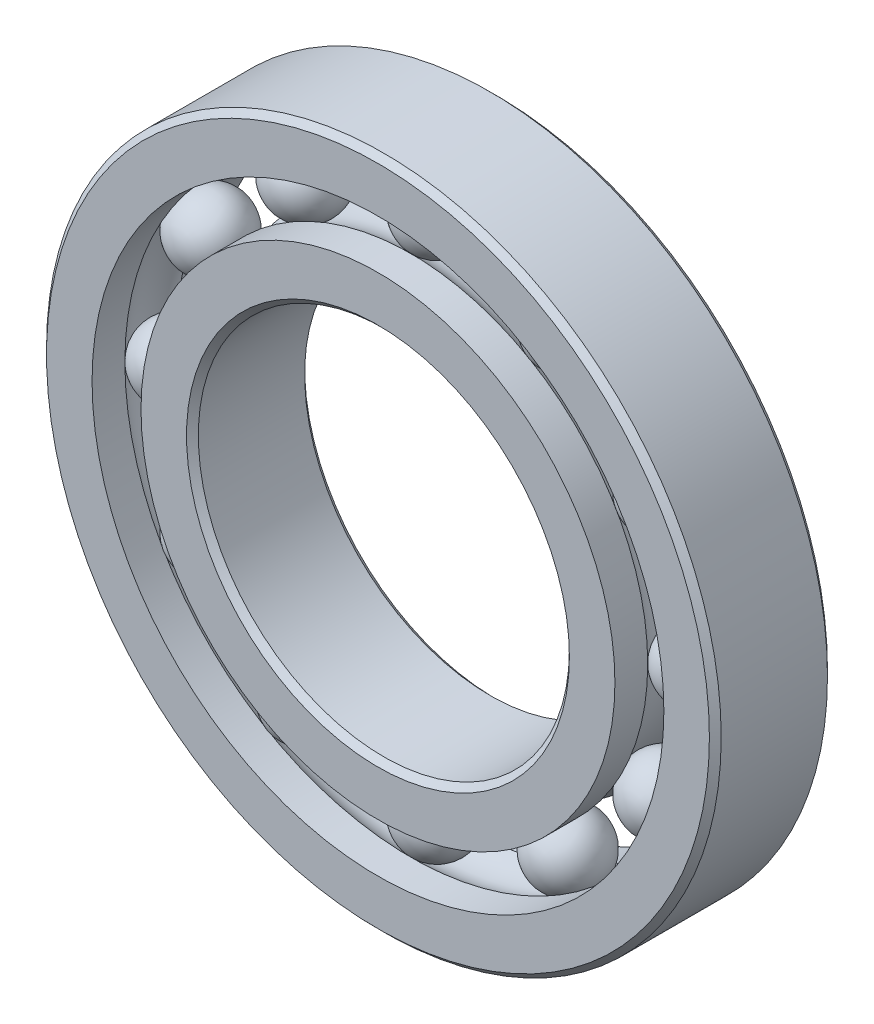
from build123d import *

# Parameters (mm, degrees)
CIRPATTERN1_COUNT = 12


with BuildPart() as part:
    # Sketch1 → Revolve1 (revolve)
    with BuildSketch(Plane(origin=(0, 0, 0), x_dir=(0, 0, -1), z_dir=(1, 0, 0))):
        with BuildLine():
            Line((5.000625, 31.75), (-5.000625, 31.75))
            Line((-5.000625, 31.75), (-5.55625, 31.194375))
            Line((-5.55625, 31.194375), (-5.55625, 26.908997253))
            Line((-5.55625, 26.908997253), (-2.469444444, 26.908997253))
            ThreePointArc((-2.469444444, 26.908997253), (0, 27.982757186), (2.469444444, 26.908997253))
            Line((2.469444444, 26.908997253), (5.55625, 26.908997253))
            Line((5.55625, 26.908997253), (5.55625, 31.194375))
            Line((5.55625, 31.194375), (5.000625, 31.75))
        make_face()
    revolve(axis=Axis((0, 0, 5.55625), (0, 0, -1)))


with BuildPart() as body_2:
    # Sketch3 → Revolve3 (revolve)
    with BuildSketch(Plane(origin=(0, 0, 0), x_dir=(0, 0, -1), z_dir=(1, 0, 0))):
        with BuildLine():
            Line((-5.55625, 22.303502747), (-2.469444444, 22.303502747))
            ThreePointArc((-2.469444444, 22.303502747), (0, 21.229742814), (2.469444444, 22.303502747))
            Line((2.469444444, 22.303502747), (5.55625, 22.303502747))
            Line((5.55625, 22.303502747), (5.55625, 18.018125))
            Line((5.55625, 18.018125), (5.000625, 17.4625))
            Line((5.000625, 17.4625), (-5.000625, 17.4625))
            Line((-5.000625, 17.4625), (-5.55625, 18.018125))
            Line((-5.55625, 18.018125), (-5.55625, 22.303502747))
        make_face()
    revolve(axis=Axis((0, 0, 5.55625), (0, 0, -1)))


with BuildPart() as body_3:
    # Sketch4 → Revolve4 (revolve)
    with BuildSketch(Plane(origin=(0, 0, 0), x_dir=(0, 0, -1), z_dir=(1, 0, 0))):
        with BuildLine():
            Line((-3.376507186, 24.60625), (3.376507186, 24.60625))
            ThreePointArc((3.376507186, 24.60625), (0, 27.982757186), (-3.376507186, 24.60625))
        make_face()
    revolve(axis=Axis((0, 24.60625, 3.376507186), (0, 0, -1)))


with BuildPart() as cirpattern1_1:
    # CirPattern1: pattern copy
    add(body_3.part.rotate(Axis((0, 0, -5.55625), (0, 0, 1)), 1 * 360 / CIRPATTERN1_COUNT))


with BuildPart() as cirpattern1_2:
    # CirPattern1: pattern copy
    add(body_3.part.rotate(Axis((0, 0, -5.55625), (0, 0, 1)), 2 * 360 / CIRPATTERN1_COUNT))


with BuildPart() as cirpattern1_3:
    # CirPattern1: pattern copy
    add(body_3.part.rotate(Axis((0, 0, -5.55625), (0, 0, 1)), 3 * 360 / CIRPATTERN1_COUNT))


with BuildPart() as cirpattern1_4:
    # CirPattern1: pattern copy
    add(body_3.part.rotate(Axis((0, 0, -5.55625), (0, 0, 1)), 4 * 360 / CIRPATTERN1_COUNT))


with BuildPart() as cirpattern1_5:
    # CirPattern1: pattern copy
    add(body_3.part.rotate(Axis((0, 0, -5.55625), (0, 0, 1)), 5 * 360 / CIRPATTERN1_COUNT))


with BuildPart() as cirpattern1_6:
    # CirPattern1: pattern copy
    add(body_3.part.rotate(Axis((0, 0, -5.55625), (0, 0, 1)), 6 * 360 / CIRPATTERN1_COUNT))


with BuildPart() as cirpattern1_7:
    # CirPattern1: pattern copy
    add(body_3.part.rotate(Axis((0, 0, -5.55625), (0, 0, 1)), 7 * 360 / CIRPATTERN1_COUNT))


with BuildPart() as cirpattern1_8:
    # CirPattern1: pattern copy
    add(body_3.part.rotate(Axis((0, 0, -5.55625), (0, 0, 1)), 8 * 360 / CIRPATTERN1_COUNT))


with BuildPart() as cirpattern1_9:
    # CirPattern1: pattern copy
    add(body_3.part.rotate(Axis((0, 0, -5.55625), (0, 0, 1)), 9 * 360 / CIRPATTERN1_COUNT))


with BuildPart() as cirpattern1_10:
    # CirPattern1: pattern copy
    add(body_3.part.rotate(Axis((0, 0, -5.55625), (0, 0, 1)), 10 * 360 / CIRPATTERN1_COUNT))


with BuildPart() as cirpattern1_11:
    # CirPattern1: pattern copy
    add(body_3.part.rotate(Axis((0, 0, -5.55625), (0, 0, 1)), 11 * 360 / CIRPATTERN1_COUNT))


solid = Compound([part.part, body_2.part, body_3.part, cirpattern1_1.part, cirpattern1_2.part, cirpattern1_3.part, cirpattern1_4.part, cirpattern1_5.part, cirpattern1_6.part, cirpattern1_7.part, cirpattern1_8.part, cirpattern1_9.part, cirpattern1_10.part, cirpattern1_11.part])
